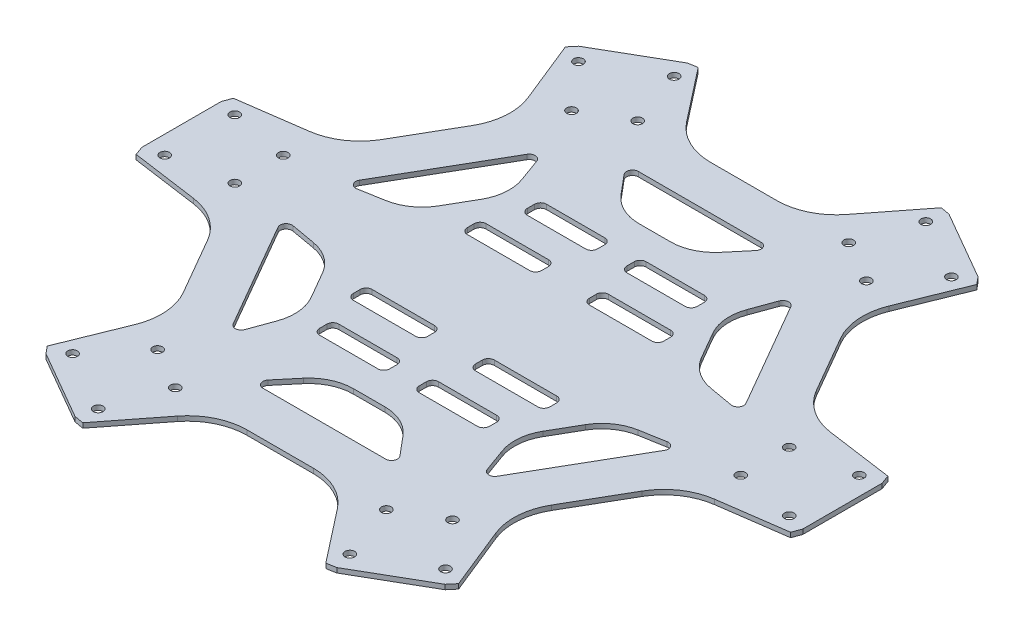
from build123d import *

# Parameters (mm, degrees)
SKETCH1_R            = 1.625
BOSS_EXTRUDE1_DEPTH  = 1.6
CIRPATTERN2_COUNT    = 6
CUT_EXTRUDE1_DEPTH   = 152.890574984
MIRROR6_COPY_1_DEPTH = 152.890574984


with BuildPart() as part:
    # Sketch1 → Boss-Extrude1 (new body)
    with BuildSketch(Plane(origin=(0, 0, 0), x_dir=(1, 0, 0), z_dir=(0, 1, 0))):
        with BuildLine():
            Line((0, 0), (-41.603860398, 24.02))
            Line((-41.603860398, 24.02), (-44.228357667, 19.474237386))
            ThreePointArc((-44.228357667, 19.474237386), (-48.615092178, 14.686956722), (-54.614016059, 12.202121091))
            Line((-54.614016059, 12.202121091), (-62.913996832, 10.738610541))
            ThreePointArc((-62.913996832, 10.738610541), (-64.899597276, 11.561073174), (-64.993343995, 13.708226047))
            Line((-64.993343995, 13.708226047), (-54.680843995, 31.57))
            Line((-54.680843995, 31.57), (-67.498019971, 38.97))
            Line((-67.498019971, 38.97), (-73.074504849, 29.311244864))
            ThreePointArc((-73.074504849, 29.311244864), (-79.211154855, 22.730493412), (-87.611550905, 19.505883489))
            Line((-87.611550905, 19.505883489), (-110.066828729, 16.35))
            Line((-110.066828729, 16.35), (-111.161293187, 13.342983613))
            Line((-111.161293187, 13.342983613), (-111.161293187, 0))
            Line((-111.161293187, 0), (-111.161293187, -13.342983613))
            Line((-111.161293187, -13.342983613), (-110.066828729, -16.35))
            Line((-110.066828729, -16.35), (-87.611550905, -19.505883489))
            ThreePointArc((-87.611550905, -19.505883489), (-79.211154855, -22.730493412), (-73.074504849, -29.311244864))
            Line((-73.074504849, -29.311244864), (-67.498019971, -38.97))
            Line((-67.498019971, -38.97), (-54.680843995, -31.57))
            Line((-54.680843995, -31.57), (-64.993343995, -13.708226047))
            ThreePointArc((-64.993343995, -13.708226047), (-64.899597276, -11.561073174), (-62.913996832, -10.738610541))
            Line((-62.913996832, -10.738610541), (-54.614016059, -12.202121091))
            ThreePointArc((-54.614016059, -12.202121091), (-48.615092178, -14.686956722), (-44.228357667, -19.474237386))
            Line((-44.228357667, -19.474237386), (-41.603860398, -24.02))
            Line((-41.603860398, -24.02), (0, 0))
        make_face()
        with Locations(Location((-105.036293187, 11.780646598, 0), (0, 0, 270))):
            Circle(SKETCH1_R, mode=Mode.SUBTRACT)
        with Locations(Location((-85.076293187, 8.143141746, 0), (0, 0, 270))):
            Circle(SKETCH1_R, mode=Mode.SUBTRACT)
        with Locations(Location((-105.036293187, -11.780646598, 0), (0, 0, 270))):
            Circle(SKETCH1_R, mode=Mode.SUBTRACT)
        with Locations(Location((-85.076293187, -8.143141746, 0), (0, 0, 270))):
            Circle(SKETCH1_R, mode=Mode.SUBTRACT)
    boss_extrude1 = extrude(amount=BOSS_EXTRUDE1_DEPTH)

    # CirPattern2: Boss-Extrude1 ×6 about axis
    cirpattern2_axis = Axis((0, 0, 0), (0, 1, 0))
    for i in range(1, CIRPATTERN2_COUNT):
        add(boss_extrude1.rotate(cirpattern2_axis, i * 360 / CIRPATTERN2_COUNT))

    # Sketch2 → Cut-Extrude1 (cut, through all)
    with BuildSketch(Plane(origin=(0, 0, 0), x_dir=(1, 0, 0), z_dir=(0, 1, 0))):
        with BuildLine():
            Line((-26.56, 38.16), (-6.96, 38.16))
            ThreePointArc((-6.96, 38.16), (-5.545786438, 37.574213562), (-4.96, 36.16))
            Line((-4.96, 36.16), (-4.96, 33.7))
            ThreePointArc((-4.96, 33.7), (-5.545786438, 32.285786438), (-6.96, 31.7))
            Line((-6.96, 31.7), (-26.56, 31.7))
            ThreePointArc((-26.56, 31.7), (-27.974213562, 32.285786438), (-28.56, 33.7))
            Line((-28.56, 33.7), (-28.56, 36.16))
            ThreePointArc((-28.56, 36.16), (-27.974213562, 37.574213562), (-26.56, 38.16))
        make_face()
        with BuildLine():
            Line((-31.05, 22.33), (-10.05, 22.33))
            ThreePointArc((-10.05, 22.33), (-8.635786438, 21.744213562), (-8.05, 20.33))
            Line((-8.05, 20.33), (-8.05, 18))
            ThreePointArc((-8.05, 18), (-8.635786438, 16.585786438), (-10.05, 16))
            Line((-10.05, 16), (-31.05, 16))
            ThreePointArc((-31.05, 16), (-32.464213562, 16.585786438), (-33.05, 18))
            Line((-33.05, 18), (-33.05, 20.33))
            ThreePointArc((-33.05, 20.33), (-32.464213562, 21.744213562), (-31.05, 22.33))
        make_face()
    cut_extrude1 = extrude(amount=CUT_EXTRUDE1_DEPTH, mode=Mode.SUBTRACT)

    # Mirror5: Cut-Extrude1 across plane
    add(cut_extrude1.mirror(Plane.XY), mode=Mode.SUBTRACT)

    # Mirror6: Cut-Extrude1 across plane
    add(cut_extrude1.mirror(Plane(origin=(0, 0, 0), x_dir=(0, 0, 1), z_dir=(1, 0, 0))), mode=Mode.SUBTRACT)

    # Mirror6 copy 1 sketch → Mirror6 copy 1 (cut, through all)
    with BuildSketch(Plane(origin=(0, 0, 0), x_dir=(-1, 0, 0), z_dir=(0, 1, 0))):
        with BuildLine():
            Line((-26.56, 38.16), (-6.96, 38.16))
            ThreePointArc((-6.96, 38.16), (-5.545786438, 37.574213562), (-4.96, 36.16))
            Line((-4.96, 36.16), (-4.96, 33.7))
            ThreePointArc((-4.96, 33.7), (-5.545786438, 32.285786438), (-6.96, 31.7))
            Line((-6.96, 31.7), (-26.56, 31.7))
            ThreePointArc((-26.56, 31.7), (-27.974213562, 32.285786438), (-28.56, 33.7))
            Line((-28.56, 33.7), (-28.56, 36.16))
            ThreePointArc((-28.56, 36.16), (-27.974213562, 37.574213562), (-26.56, 38.16))
        make_face()
        with BuildLine():
            Line((-31.05, 22.33), (-10.05, 22.33))
            ThreePointArc((-10.05, 22.33), (-8.635786438, 21.744213562), (-8.05, 20.33))
            Line((-8.05, 20.33), (-8.05, 18))
            ThreePointArc((-8.05, 18), (-8.635786438, 16.585786438), (-10.05, 16))
            Line((-10.05, 16), (-31.05, 16))
            ThreePointArc((-31.05, 16), (-32.464213562, 16.585786438), (-33.05, 18))
            Line((-33.05, 18), (-33.05, 20.33))
            ThreePointArc((-33.05, 20.33), (-32.464213562, 21.744213562), (-31.05, 22.33))
        make_face()
    extrude(amount=MIRROR6_COPY_1_DEPTH, mode=Mode.SUBTRACT)


solid = part.part
